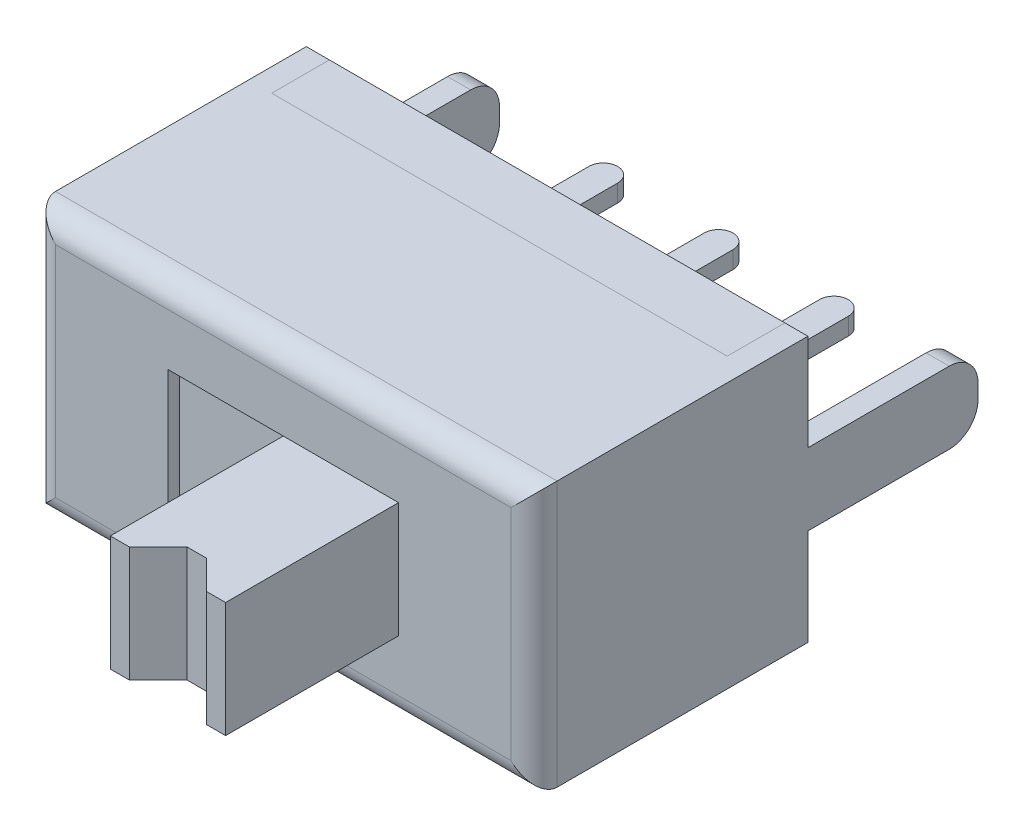
from build123d import *

# Parameters (mm, degrees)
SKETCH1_W                         = 8.7
SKETCH1_H                         = 4.6
BOSS_EXTRUDE1_DEPTH               = 4.75
FILLET2_R                         = 0.4
SKETCH2_W                         = 4
SKETCH2_H                         = 2
CUT_EXTRUDE1_DEPTH                = 0.2
BOSS_EXTRUDE2_DEPTH               = 2
SKETCH8_W                         = 7.9
SKETCH8_H                         = 4.6
CUT_EXTRUDE2_DEPTH                = 1
SKETCH5_W                         = 0.4
SKETCH5_H                         = 1.25
BOSS_EXTRUDE3_DEPTH               = 2.95
FILLET3_R                         = 0.5
FILLET3_OF_MIRROR1_R              = 0.5
SKETCH10_W                        = 0.5
SKETCH10_H                        = 0.3
BOSS_EXTRUDE6_DEPTH               = 4.05
FILLET5_RADIUS                    = 0.25
FILLET5_LENGTH                    = 0.3
LPATTERN3_COUNT                   = 2
LPATTERN3_PITCH                   = 2
FILLET5_OF_LPATTERN3_2_RADIUS     = 0.25
FILLET5_OF_LPATTERN3_2_LENGTH     = 0.3
LPATTERN3_COL_COUNT               = 2
LPATTERN3_COL_PITCH               = 2
FILLET5_OF_LPATTERN3_COL_2_RADIUS = 0.25
FILLET5_OF_LPATTERN3_COL_2_LENGTH = 0.3
SKETCH9_W                         = 7.9
SKETCH9_H                         = 4.6
BOSS_EXTRUDE7_DEPTH               = 1


with BuildPart() as part:
    # Sketch1 → Boss-Extrude1 (new body)
    with BuildSketch(Plane.XY):
        Rectangle(SKETCH1_W, SKETCH1_H)
    extrude(amount=BOSS_EXTRUDE1_DEPTH)

    # Fillet2
    fillet2_edges = [part.edges().sort_by_distance(p)[0] for p in [
        (-4.35, 0, 4.75),
        (0, -2.3, 4.75),
        (4.35, 0, 4.75),
        (0, 2.3, 4.75),
    ]]
    fillet(fillet2_edges, radius=FILLET2_R)

    # Sketch2 → Cut-Extrude1 (cut)
    with BuildSketch(Plane.XY.offset(4.75)):
        Rectangle(SKETCH2_W, SKETCH2_H)
    extrude(amount=-CUT_EXTRUDE1_DEPTH, mode=Mode.SUBTRACT)

    # Sketch4 → Boss-Extrude2 (add)
    with BuildSketch(Plane(origin=(0, -1, 0), x_dir=(1, 0, 0), z_dir=(0, 1, 0))):
        Polygon((2, -4.55), (2, -7.75), (1.666666667, -7.75), (1.166666667, -7.25), (0.833333333, -7.25), (0.333333333, -7.75), (0, -7.75), (0, -4.55), align=None)
    extrude(amount=BOSS_EXTRUDE2_DEPTH)

    # Sketch8 → Cut-Extrude2 (cut)
    with BuildSketch(Plane(origin=(0, 0, 0), x_dir=(-1, 0, 0), z_dir=(0, 0, -1))):
        Rectangle(SKETCH8_W, SKETCH8_H)
    extrude(amount=-CUT_EXTRUDE2_DEPTH, mode=Mode.SUBTRACT)

    # Sketch5 → Boss-Extrude3 (add)
    with BuildSketch(Plane(origin=(0, 0, 0), x_dir=(-1, 0, 0), z_dir=(0, 0, -1))):
        with Locations((-4.15, 0)):
            Rectangle(SKETCH5_W, SKETCH5_H)
    boss_extrude3 = extrude(amount=BOSS_EXTRUDE3_DEPTH)

    # Fillet3
    fillet3_edges = [part.edges().sort_by_distance(p)[0] for p in [
        (4.15, 0.625, -2.95),
        (4.15, -0.625, -2.95),
    ]]
    fillet(fillet3_edges, radius=FILLET3_R)

    # Mirror1: Boss-Extrude3 across plane
    add(boss_extrude3.mirror(Plane(origin=(0, 0, 0), x_dir=(0, 0, 1), z_dir=(1, 0, 0))))

    # Fillet3 of Mirror1
    fillet3_of_mirror1_edges = [part.edges().sort_by_distance(p)[0] for p in [
        (-4.15, 0.625, -2.95),
        (-4.15, -0.625, -2.95),
    ]]
    fillet(fillet3_of_mirror1_edges, radius=FILLET3_OF_MIRROR1_R)

    # Sketch10 → Boss-Extrude6 (add)
    with BuildSketch(Plane(origin=(0, 0, 1), x_dir=(-1, 0, 0), z_dir=(0, 0, -1))):
        Rectangle(SKETCH10_W, SKETCH10_H)
    boss_extrude6 = extrude(amount=BOSS_EXTRUDE6_DEPTH)

    # Fillet5: full round fillet: the end face becomes a half cylinder, R = half its width
    fillet5_face = Plane((0, 0, -3.05), x_dir=(0, -1, 0), z_dir=(0, 0, -1))  # on the end face: x along it, z out of the body
    fillet5_slab = fillet5_face.offset(-FILLET5_RADIUS / 2) * Box(FILLET5_LENGTH, 2 * FILLET5_RADIUS, FILLET5_RADIUS, mode=Mode.PRIVATE)  # the body's end, R deep
    fillet5_round = Plane((0, 0, -2.8), x_dir=(0, 0, -1), z_dir=(0, -1, 0)) * Cylinder(FILLET5_RADIUS, FILLET5_LENGTH, mode=Mode.PRIVATE)  # its axis R under the face
    add(fillet5_slab - fillet5_round, mode=Mode.SUBTRACT)

    # LPattern3: Boss-Extrude6 ×2
    with Locations(*[(i * LPATTERN3_PITCH, 0, 0) for i in range(1, LPATTERN3_COUNT)]):
        add(boss_extrude6)

    # Fillet5 of LPattern3 2: full round fillet: the end face becomes a half cylinder, R = half its width
    fillet5_of_lpattern3_2_face = Plane((2, 0, -3.05), x_dir=(0, -1, 0), z_dir=(0, 0, -1))  # on the end face: x along it, z out of the body
    fillet5_of_lpattern3_2_slab = fillet5_of_lpattern3_2_face.offset(-FILLET5_OF_LPATTERN3_2_RADIUS / 2) * Box(FILLET5_OF_LPATTERN3_2_LENGTH, 2 * FILLET5_OF_LPATTERN3_2_RADIUS, FILLET5_OF_LPATTERN3_2_RADIUS, mode=Mode.PRIVATE)  # the body's end, R deep
    fillet5_of_lpattern3_2_round = Plane((2, 0, -2.8), x_dir=(0, 0, -1), z_dir=(0, -1, 0)) * Cylinder(FILLET5_OF_LPATTERN3_2_RADIUS, FILLET5_OF_LPATTERN3_2_LENGTH, mode=Mode.PRIVATE)  # its axis R under the face
    add(fillet5_of_lpattern3_2_slab - fillet5_of_lpattern3_2_round, mode=Mode.SUBTRACT)

    # LPattern3 col: Boss-Extrude6 ×2
    with Locations(*[(-i * LPATTERN3_COL_PITCH, 0, 0) for i in range(1, LPATTERN3_COL_COUNT)]):
        add(boss_extrude6)

    # Fillet5 of LPattern3 col 2: full round fillet: the end face becomes a half cylinder, R = half its width
    fillet5_of_lpattern3_col_2_face = Plane((-2, 0, -3.05), x_dir=(0, -1, 0), z_dir=(0, 0, -1))  # on the end face: x along it, z out of the body
    fillet5_of_lpattern3_col_2_slab = fillet5_of_lpattern3_col_2_face.offset(-FILLET5_OF_LPATTERN3_COL_2_RADIUS / 2) * Box(FILLET5_OF_LPATTERN3_COL_2_LENGTH, 2 * FILLET5_OF_LPATTERN3_COL_2_RADIUS, FILLET5_OF_LPATTERN3_COL_2_RADIUS, mode=Mode.PRIVATE)  # the body's end, R deep
    fillet5_of_lpattern3_col_2_round = Plane((-2, 0, -2.8), x_dir=(0, 0, -1), z_dir=(0, -1, 0)) * Cylinder(FILLET5_OF_LPATTERN3_COL_2_RADIUS, FILLET5_OF_LPATTERN3_COL_2_LENGTH, mode=Mode.PRIVATE)  # its axis R under the face
    add(fillet5_of_lpattern3_col_2_slab - fillet5_of_lpattern3_col_2_round, mode=Mode.SUBTRACT)


with BuildPart() as body_2:
    # Sketch9 → Boss-Extrude7 (new body)
    with BuildSketch(Plane(origin=(0, 0, 1), x_dir=(-1, 0, 0), z_dir=(0, 0, -1))):
        Rectangle(SKETCH9_W, SKETCH9_H)
    extrude(amount=BOSS_EXTRUDE7_DEPTH)


solid = Compound([part.part, body_2.part])
